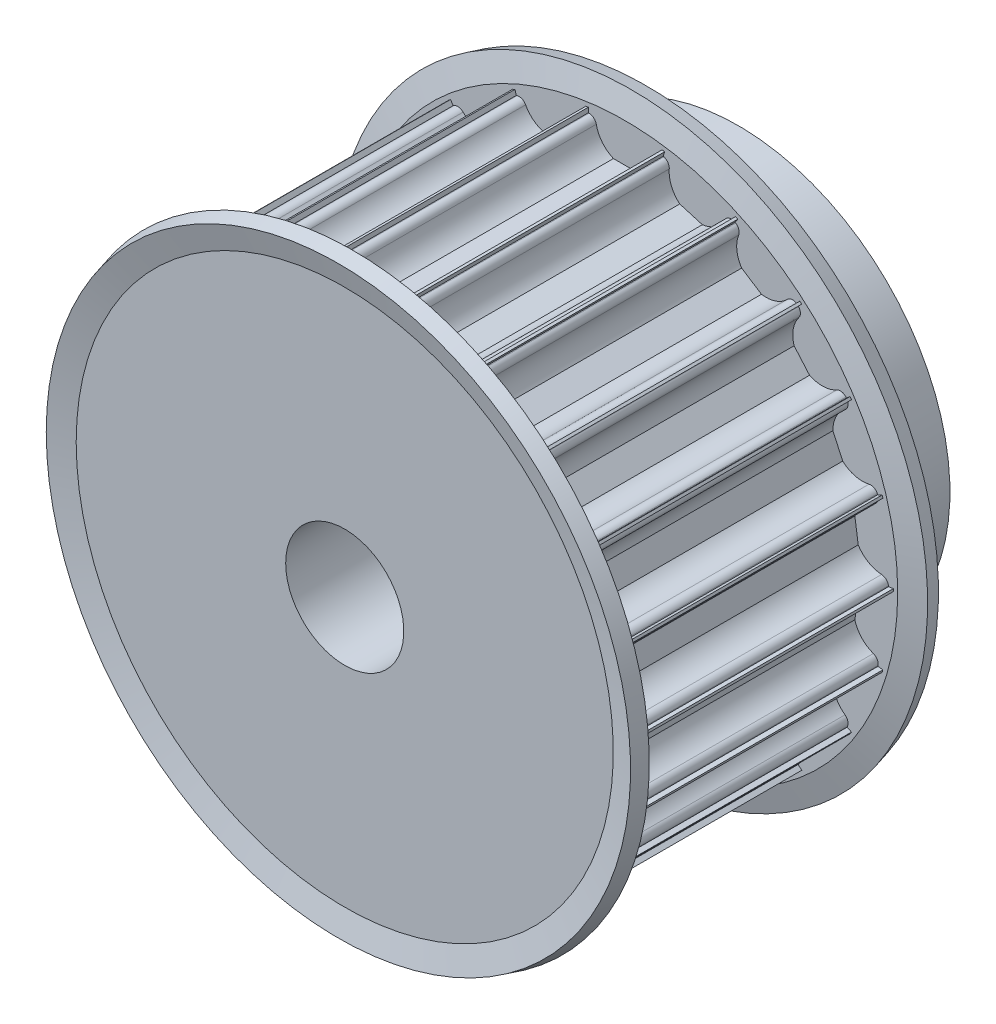
from build123d import *

# Parameters (mm, degrees)
CUT_EXTRUDE1_DEPTH = 56.543901555
CIRPATTERN1_COUNT  = 22


with BuildPart() as part:
    # Sketch1 → Revolve1 (revolve)
    with BuildSketch(Plane(origin=(0, 0, 0), x_dir=(0, 0, -1), z_dir=(1, 0, 0)), mode=Mode.PRIVATE) as revolve1_sk:
        Polygon((0, 6), (0, 27.25), (30, 27.25), (30, 21.5), (40, 21.5), (40, 6), align=None)
    revolve(revolve1_sk.sketch.rotate(Axis((0, 0, -88.99), (0, 0, 1)), 90), axis=Axis((0, 0, -88.99), (0, 0, 1)))

    # Sketch2 → Cut-Extrude1 (cut, through all)
    with BuildSketch(Plane.XY):
        with BuildLine():
            Line((3.674234614, 26.5), (3.75, 26.5))
            Line((3.75, 26.5), (3.75, 28.5))
            Line((3.75, 28.5), (-3.75, 28.5))
            Line((-3.75, 28.5), (-3.75, 26.5))
            Line((-3.75, 26.5), (-3.674234614, 26.5))
            ThreePointArc((-3.674234614, 26.5), (-3.199892965, 26.330947502), (-2.939387691, 25.9))
            ThreePointArc((-2.939387691, 25.9), (-2.331759211, 24.612435701), (-1.198957881, 23.75))
            Line((-1.198957881, 23.75), (1.198957881, 23.75))
            ThreePointArc((1.198957881, 23.75), (2.331759211, 24.612435701), (2.939387691, 25.9))
            ThreePointArc((2.939387691, 25.9), (3.199892965, 26.330947502), (3.674234614, 26.5))
        make_face()
    cut_extrude1 = extrude(amount=-CUT_EXTRUDE1_DEPTH, mode=Mode.SUBTRACT)

    # CirPattern1: Cut-Extrude1 ×22 about axis
    cirpattern1_axis = Axis((0, 0, 0), (0, 0, 1))
    for i in range(1, CIRPATTERN1_COUNT):
        add(cut_extrude1.rotate(cirpattern1_axis, i * 360 / CIRPATTERN1_COUNT), mode=Mode.SUBTRACT)

    # Sketch3 → Revolve2 (revolve)
    with BuildSketch(Plane(origin=(0, 0, 0), x_dir=(0, 0, -1), z_dir=(1, 0, 0)), mode=Mode.PRIVATE) as revolve2_sk:
        Polygon((-0.643078062, 29.688815364), (0, 27.288815364), (0, 22.690739153), (1.5, 22.690739153), (1.5, 27.690739153), (0.856921938, 30.090739153), align=None)
        Polygon((30.643078062, 29.688815364), (29.143078062, 30.090739153), (28.5, 27.690739153), (28.5, 22.690739153), (30, 22.690739153), (30, 27.288815364), align=None)
    revolve(revolve2_sk.sketch.rotate(Axis((0, 0, -88.99), (0, 0, 1)), 90), axis=Axis((0, 0, -88.99), (0, 0, 1)))


solid = part.part
